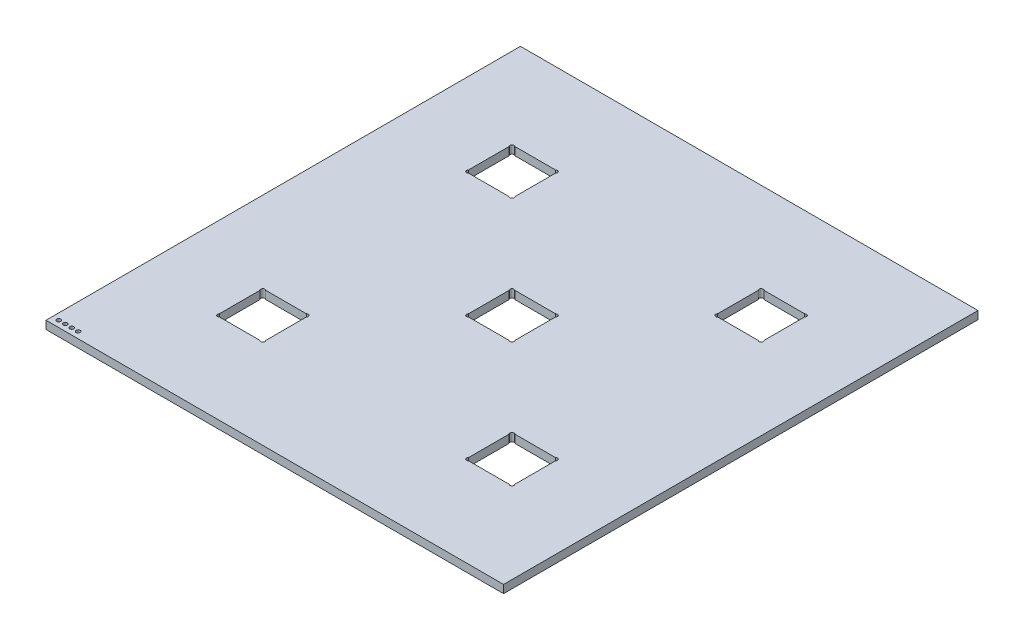
from build123d import *

# Parameters (mm, degrees)
SKETCH1_W           = 180.7718
SKETCH1_H           = 187.452
BOSS_EXTRUDE1_DEPTH = 3.175
SKETCH2_W           = 18.288
SKETCH2_H           = 18.288
CUT_EXTRUDE1_DEPTH  = 3.175
SKETCH3_R           = 0.79375
CUT_EXTRUDE2_DEPTH  = 131.246898696
SKETCH9_R           = 0.79375
CUT_EXTRUDE4_DEPTH  = 1.27
LPATTERN1_COUNT     = 4
LPATTERN1_PITCH     = 2.54


with BuildPart() as part:
    # Sketch1 → Boss-Extrude1 (new body)
    with BuildSketch(Plane(origin=(0, 0, 0), x_dir=(1, 0, 0), z_dir=(0, 1, 0))):
        Rectangle(SKETCH1_W, SKETCH1_H)
    extrude(amount=BOSS_EXTRUDE1_DEPTH)

    # Sketch2 → Cut-Extrude1 (cut)
    with BuildSketch(Plane(origin=(0, 3.175, 0), x_dir=(1, 0, 0), z_dir=(0, 1, 0))):
        Rectangle(SKETCH2_W, SKETCH2_H)
    cut_extrude1 = extrude(amount=-CUT_EXTRUDE1_DEPTH, mode=Mode.SUBTRACT)

    # Sketch3 → Cut-Extrude2 (cut, through all)
    with BuildSketch(Plane(origin=(0, 3.175, 0), x_dir=(1, 0, 0), z_dir=(0, 1, 0))):
        with Locations((8.582733992, -8.582733992)):
            Circle(SKETCH3_R)
        with Locations((-8.582733992, -8.582733992)):
            Circle(SKETCH3_R)
        with Locations((-8.582733992, 8.582733992)):
            Circle(SKETCH3_R)
        with Locations((8.582733992, 8.582733992)):
            Circle(SKETCH3_R)
    cut_extrude2 = extrude(amount=-CUT_EXTRUDE2_DEPTH, mode=Mode.SUBTRACT)

    # Sketch-Pattern1: Cut-Extrude1, Cut-Extrude2 at 4 more places
    with Locations((-49.2125, 0, 49.2125), (-49.2125, 0, -49.2125), (49.2125, 0, -49.2125), (49.2125, 0, 49.2125)):
        add(cut_extrude1, mode=Mode.SUBTRACT)
        add(cut_extrude2, mode=Mode.SUBTRACT)

    # Sketch9 → Cut-Extrude4 (cut)
    with BuildSketch(Plane(origin=(0, 3.175, 0), x_dir=(1, 0, 0), z_dir=(0, 1, 0))):
        with Locations(Location((-87.8459, -91.186, 0), (0, 0, 270))):
            Circle(SKETCH9_R)
    cut_extrude4 = extrude(amount=-CUT_EXTRUDE4_DEPTH, mode=Mode.SUBTRACT)

    # LPattern1: Cut-Extrude4 ×4
    with Locations(*[(i * LPATTERN1_PITCH, 0, 0) for i in range(1, LPATTERN1_COUNT)]):
        add(cut_extrude4, mode=Mode.SUBTRACT)


solid = part.part
